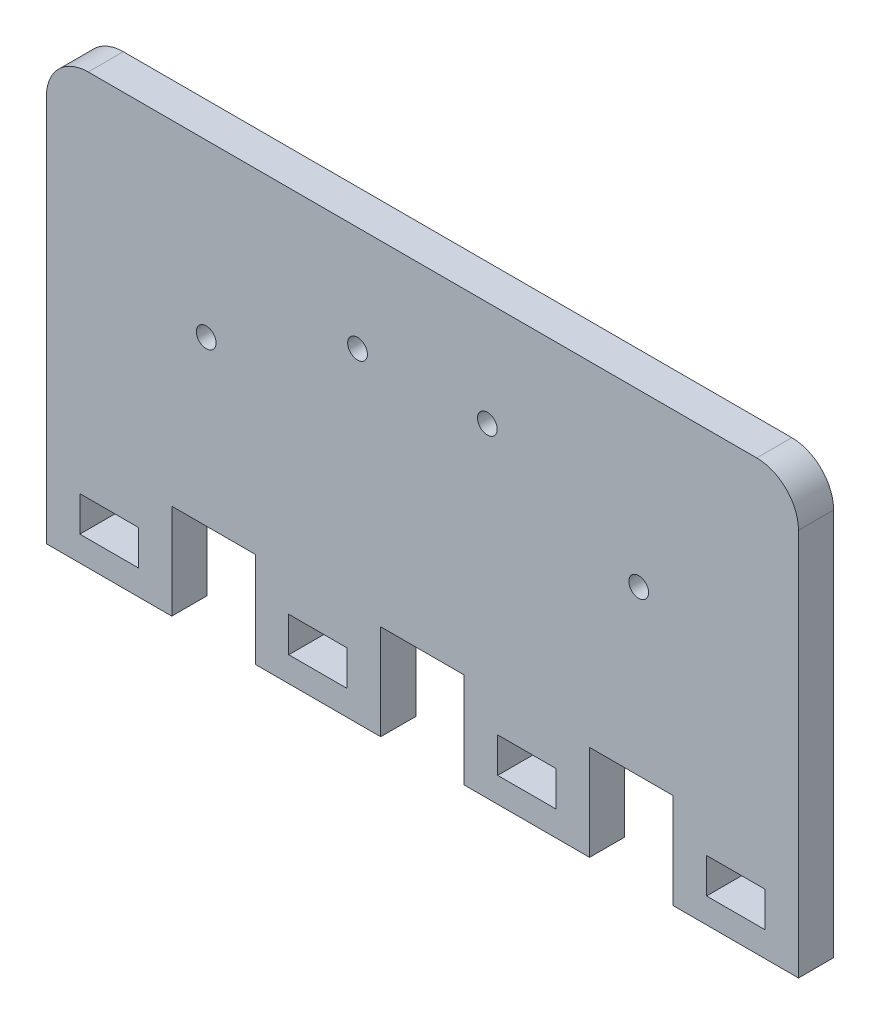
from build123d import *

# Parameters (mm, degrees)
SKETCH1_W           = 114.3
SKETCH1_H           = 56.134
BOSS_EXTRUDE1_DEPTH = 5.334
SKETCH2_W           = 12.7
SKETCH2_H           = 5.334
CUT_EXTRUDE1_DEPTH  = 90.417531181
FILLET1_R           = 6.35
SKETCH3_R           = 1.5
CUT_EXTRUDE2_DEPTH  = 90.417531181
SKETCH4_W           = 19.05
SKETCH4_H           = 5.334
BOSS_EXTRUDE2_DEPTH = 9.144
SKETCH6_W           = 8.89
SKETCH6_H           = 5.334
CUT_EXTRUDE3_DEPTH  = 93.966642796


with BuildPart() as part:
    # Sketch1 → Boss-Extrude1 (new body)
    with BuildSketch(Plane.XY):
        with Locations((26.61749153, -2.755892293)):
            Rectangle(SKETCH1_W, SKETCH1_H)
    extrude(amount=BOSS_EXTRUDE1_DEPTH)

    # Sketch2 → Cut-Extrude1 (cut, through all)
    with BuildSketch(Plane.XY.offset(5.334)):
        with Locations((-5.13250847, -28.155892293)):
            Rectangle(SKETCH2_W, SKETCH2_H)
        with Locations((26.61749153, -28.155892293)):
            Rectangle(SKETCH2_W, SKETCH2_H)
        with Locations((58.36749153, -28.155892293)):
            Rectangle(SKETCH2_W, SKETCH2_H)
    extrude(amount=-CUT_EXTRUDE1_DEPTH, mode=Mode.SUBTRACT)

    # Fillet1
    fillet1_edges = [part.edges().sort_by_distance(p)[0] for p in [
        (-30.53250847, 25.311107707, 2.667),
        (83.76749153, 25.311107707, 2.667),
    ]]
    fillet(fillet1_edges, radius=FILLET1_R)

    # Sketch3 → Cut-Extrude2 (cut, through all)
    with BuildSketch(Plane(origin=(0, 0, 0), x_dir=(-1, 0, 0), z_dir=(0, 0, -1))):
        with Locations((6.24850847, -0.644892293)):
            Circle(SKETCH3_R)
        with Locations((-16.75149153, 9.355107707)):
            Circle(SKETCH3_R)
        with Locations((-59.48349153, -0.644892293)):
            Circle(SKETCH3_R)
        with Locations((-36.48349153, 9.355107707)):
            Circle(SKETCH3_R)
    extrude(amount=-CUT_EXTRUDE2_DEPTH, mode=Mode.SUBTRACT)

    # Sketch4 → Boss-Extrude2 (add)
    with BuildSketch(Plane(origin=(0, -30.822892293, 0), x_dir=(-1, 0, 0), z_dir=(0, -1, 0))):
        with Locations((-10.74249153, -2.667)):
            Rectangle(SKETCH4_W, SKETCH4_H)
        with Locations((21.00750847, -2.667)):
            Rectangle(SKETCH4_W, SKETCH4_H)
        with Locations((-42.49249153, -2.667)):
            Rectangle(SKETCH4_W, SKETCH4_H)
        with Locations((-74.24249153, -2.667)):
            Rectangle(SKETCH4_W, SKETCH4_H)
    extrude(amount=BOSS_EXTRUDE2_DEPTH)

    # Sketch6 → Cut-Extrude3 (cut, through all)
    with BuildSketch(Plane.XY.offset(5.334)):
        with Locations((-21.00750847, -33.489892293)):
            Rectangle(SKETCH6_W, SKETCH6_H)
        with Locations((10.74249153, -33.489892293)):
            Rectangle(SKETCH6_W, SKETCH6_H)
        with Locations((42.49249153, -33.489892293)):
            Rectangle(SKETCH6_W, SKETCH6_H)
        with Locations((74.24249153, -33.489892293)):
            Rectangle(SKETCH6_W, SKETCH6_H)
    extrude(amount=-CUT_EXTRUDE3_DEPTH, mode=Mode.SUBTRACT)


solid = part.part
